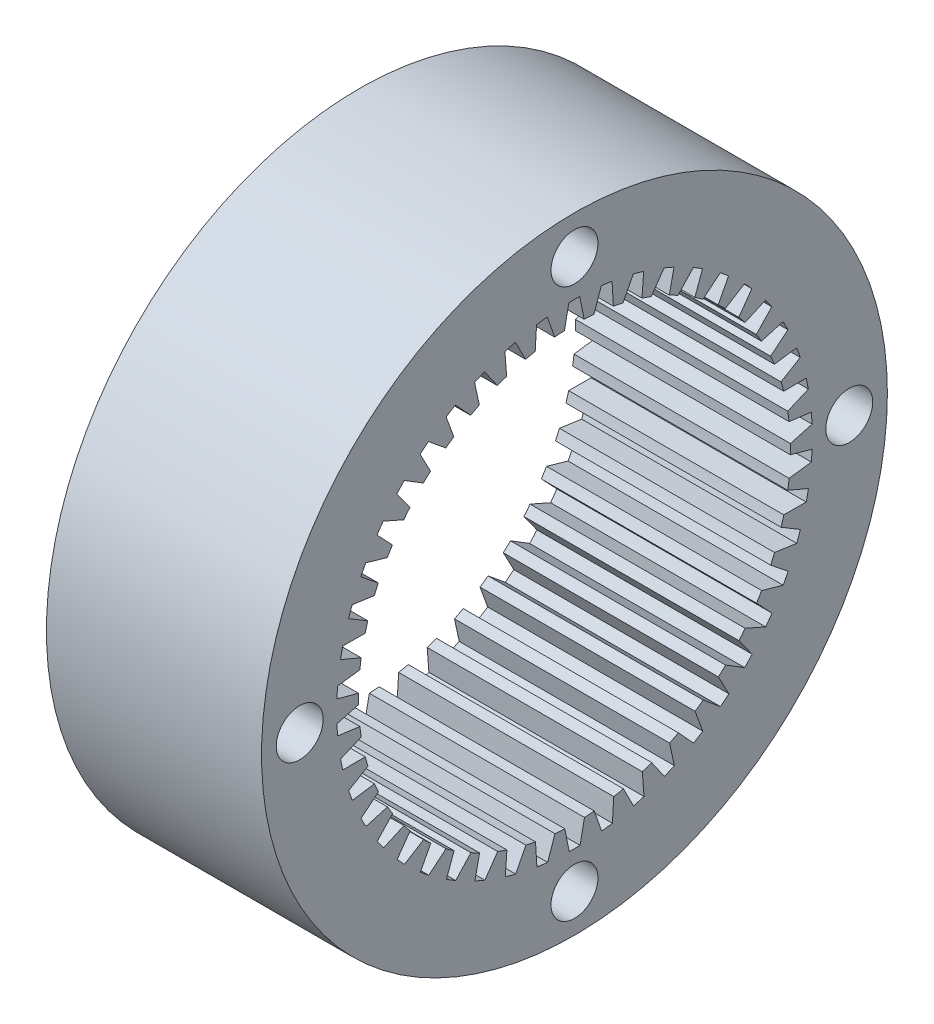
from build123d import *

# Parameters (mm, degrees)
ESQUISSE1_R        = 16
ESQUISSE1_R_2      = 1.2
BOSS_EXTRU_1_DEPTH = 11


with BuildPart() as part:
    # Esquisse1 → Boss.-Extru.1 (new body)
    with BuildSketch(Plane(origin=(0, 0, 0), x_dir=(0, -1, 0), z_dir=(-1, 0, 0))):
        with Locations(Location((0, 0, 0), (0, 0, 270))):
            Circle(ESQUISSE1_R)
        with Locations(Location((0, -14.05, 0), (0, 0, 270))):
            Circle(ESQUISSE1_R_2, mode=Mode.SUBTRACT)
        with Locations(Location((14.05, 0, 0), (0, 0, 270))):
            Circle(ESQUISSE1_R_2, mode=Mode.SUBTRACT)
        with Locations(Location((0, 14.05, 0), (0, 0, 270))):
            Circle(ESQUISSE1_R_2, mode=Mode.SUBTRACT)
        with Locations(Location((-14.05, 0, 0), (0, 0, 270))):
            Circle(ESQUISSE1_R_2, mode=Mode.SUBTRACT)
        with BuildLine():
            Line((5.515041085, -9.56897602), (5.831213426, -10.671779185))
            ThreePointArc((5.831213426, -10.671779185), (5.586655697, -10.801814622), (5.339199898, -10.926246631))
            Line((5.339199898, -10.926246631), (4.621931319, -10.03088885))
            ThreePointArc((4.621931319, -10.03088885), (4.392452427, -10.1334763), (4.160698295, -10.230814726))
            Line((4.160698295, -10.230814726), (4.323760778, -11.36639845))
            ThreePointArc((4.323760778, -11.36639845), (4.063774383, -11.461922123), (3.801679911, -11.55149994))
            Line((3.801679911, -11.55149994), (3.213009879, -10.56681351))
            ThreePointArc((3.213009879, -10.56681351), (2.971699377, -10.637198083), (2.728849568, -10.70207271))
            Line((2.728849568, -10.70207271), (2.735764647, -11.849283219))
            ThreePointArc((2.735764647, -11.849283219), (2.465192642, -11.908515703), (2.19334182, -11.96157066))
            Line((2.19334182, -11.96157066), (1.744236145, -10.905898428))
            ThreePointArc((1.744236145, -10.905898428), (1.49558919, -10.942768993), (1.246167536, -10.973971329))
            Line((1.246167536, -10.973971329), (1.096806398, -12.11143826))
            ThreePointArc((1.096806398, -12.11143826), (0.820689025, -12.133276166), (0.544145921, -12.148819952))
            Line((0.544145921, -12.148819952), (0.242970591, -11.041827093))
            ThreePointArc((0.242970591, -11.041827093), (-0.008380994, -11.04449682), (-0.259728238, -11.041445625))
            Line((-0.259728238, -11.041445625), (-0.56258328, -12.147980122))
            ThreePointArc((-0.56258328, -12.147980122), (-0.839102475, -12.132016652), (-1.115186386, -12.109759714))
            Line((-1.115186386, -12.109759714), (-1.262821045, -10.97206741))
            ThreePointArc((-1.262821045, -10.97206741), (-1.512195056, -10.940486569), (-1.760785767, -10.903238681))
            Line((-1.760785767, -10.903238681), (-2.211493095, -11.9582281))
            ThreePointArc((-2.211493095, -11.9582281), (-2.483263083, -11.904760622), (-2.753744882, -11.845117565))
            Line((-2.753744882, -11.845117565), (-2.745088715, -10.697918872))
            ThreePointArc((-2.745088715, -10.697918872), (-2.987839785, -10.632675753), (-3.229043189, -10.56192503))
            Line((-3.229043189, -10.56192503), (-3.819206979, -11.545716914))
            ThreePointArc((-3.819206979, -11.545716914), (-4.081165199, -11.455741426), (-4.34100632, -11.359823288))
            Line((-4.34100632, -11.359823288), (-4.176220576, -10.224488347))
            ThreePointArc((-4.176220576, -10.224488347), (-4.407826713, -10.126798306), (-4.637149646, -10.023862699))
            Line((-4.637149646, -10.023862699), (-5.355776262, -10.918130867))
            ThreePointArc((-5.355776262, -10.918130867), (-5.603042929, -10.793323443), (-5.847403025, -10.662916996))
            Line((-5.847403025, -10.662916996), (-5.529557349, -9.560594949))
            ThreePointArc((-5.529557349, -9.560594949), (-5.745704168, -9.432277766), (-5.958874779, -9.299074772))
            Line((-5.958874779, -9.299074772), (-6.792577568, -10.0871607))
            ThreePointArc((-6.792577568, -10.0871607), (-7.020546571, -9.929846265), (-7.244873674, -9.767380736))
            Line((-7.244873674, -9.767380736), (-6.779888931, -8.718605756))
            ThreePointArc((-6.779888931, -8.718605756), (-6.976550026, -8.562051739), (-7.169597349, -8.401062677))
            Line((-7.169597349, -8.401062677), (-8.102846005, -9.068285815))
            ThreePointArc((-8.102846005, -9.068285815), (-8.307270713, -8.88139484), (-8.507386035, -8.689896654))
            Line((-8.507386035, -8.689896654), (-7.90392401, -7.714205435))
            ThreePointArc((-7.90392401, -7.714205435), (-8.077435958, -7.532330888), (-8.246763886, -7.34655468))
            Line((-8.246763886, -7.34655468), (-9.262173753, -7.880485923))
            ThreePointArc((-9.262173753, -7.880485923), (-9.43924612, -7.667499833), (-9.611421891, -7.450536238))
            Line((-9.611421891, -7.450536238), (-8.88072394, -6.566104062))
            ThreePointArc((-8.88072394, -6.566104062), (-9.02785454, -6.362296964), (-9.170308815, -6.155194269))
            Line((-9.170308815, -6.155194269), (-10.248964728, -6.545887488))
            ThreePointArc((-10.248964728, -6.545887488), (-10.395386231, -6.310773812), (-10.536415142, -6.07238643))
            Line((-10.536415142, -6.07238643), (-9.692092786, -5.295688594))
            ThreePointArc((-9.692092786, -5.295688594), (-9.810101274, -5.073745485), (-9.923028242, -4.849174235))
            Line((-9.923028242, -4.849174235), (-11.044836882, -5.089351555))
            ThreePointArc((-11.044836882, -5.089351555), (-11.157879966, -4.836490015), (-11.265134915, -4.581119551))
            Line((-11.265134915, -4.581119551), (-10.322916281, -3.926624467))
            ThreePointArc((-10.322916281, -3.926624467), (-10.409604382, -3.690679728), (-10.490900428, -3.452823259))
            Line((-10.490900428, -3.452823259), (-11.634964623, -3.538010632))
            ThreePointArc((-11.634964623, -3.538010632), (-11.712523509, -3.27211156), (-11.784006539, -3.004515084))
            Line((-11.784006539, -3.004515084), (-10.761443378, -2.484414756))
            ThreePointArc((-10.761443378, -2.484414756), (-10.815196257, -2.238863591), (-10.863346988, -1.99215272))
            Line((-10.863346988, -1.99215272), (-12.008354986, -1.920763265))
            ThreePointArc((-12.008354986, -1.920763265), (-12.048984899, -1.646779857), (-12.083364417, -1.371942185))
            Line((-12.083364417, -1.371942185), (-10.999505146, -0.995925099))
            ThreePointArc((-10.999505146, -0.995925099), (-11.019321488, -0.745341661), (-11.033429949, -0.494372145))
            Line((-11.033429949, -0.494372145), (-12.158052418, -0.267735713))
            ThreePointArc((-12.158052418, -0.267735713), (-12.160996499, 0.009228238), (-12.157632079, 0.286187401))
            Line((-12.157632079, 0.286187401), (-11.032666945, 0.511116758))
            ThreePointArc((-11.032666945, 0.511116758), (-11.01817761, 0.762064574), (-10.997980985, 1.012617648))
            Line((-10.997980985, 1.012617648), (-12.081268336, 1.390279249))
            ThreePointArc((-12.081268336, 1.390279249), (-12.046471743, 1.665064428), (-12.005426058, 1.938985858))
            Line((-12.005426058, 1.938985858), (-10.860311033, 2.008637478))
            ThreePointArc((-10.860311033, 2.008637478), (-10.811785929, 2.255274987), (-10.757660445, 2.50074429))
            Line((-10.757660445, 2.50074429), (-11.779433084, 3.022395939))
            ThreePointArc((-11.779433084, 3.022395939), (-11.707544011, 3.289883619), (-11.629581665, 3.555664676))
            Line((-11.629581665, 3.555664676), (-10.485648075, 3.468741081))
            ThreePointArc((-10.485648075, 3.468741081), (-10.403991134, 3.706473895), (-10.316945045, 3.942286798))
            Line((-10.316945045, 3.942286798), (-11.258169281, 4.598211112))
            ThreePointArc((-11.258169281, 4.598211112), (-11.150526886, 4.853418503), (-11.03710017, 5.106108189))
            Line((-11.03710017, 5.106108189), (-9.915657334, 4.864228602))
            ThreePointArc((-9.915657334, 4.864228602), (-9.802389669, 5.088628207), (-9.684044479, 5.310391962))
            Line((-9.684044479, 5.310391962), (-10.527187086, 6.088370312))
            ThreePointArc((-10.527187086, 6.088370312), (-10.385796543, 6.326543383), (-10.239018381, 6.561434568))
            Line((-10.239018381, 6.561434568), (-9.160956657, 6.169104747))
            ThreePointArc((-9.160956657, 6.169104747), (-9.018188231, 6.375991004), (-8.870748487, 6.579574571))
            Line((-8.870748487, 6.579574571), (-9.600103314, 7.465114692))
            ThreePointArc((-9.600103314, 7.465114692), (-9.427598461, 7.68181673), (-9.250203053, 7.894533835))
            Line((-9.250203053, 7.894533835), (-8.235604691, 7.359062143))
            ThreePointArc((-8.235604691, 7.359062143), (-8.065995009, 7.544581152), (-7.892207235, 7.726192155))
            Line((-7.892207235, 7.726192155), (-8.494187781, 8.70279811))
            ThreePointArc((-8.494187781, 8.70279811), (-8.293782057, 8.893992365), (-8.089073944, 9.080572874))
            Line((-8.089073944, 9.080572874), (-7.156838992, 8.411934135))
            ThreePointArc((-7.156838992, 8.411934135), (-6.963547562, 8.572630028), (-6.766649095, 8.728885397))
            Line((-6.766649095, 8.728885397), (-7.230041601, 9.778364866))
            ThreePointArc((-7.230041601, 9.778364866), (-7.005468186, 9.940489752), (-6.777260693, 10.097458022))
            Line((-6.777260693, 10.097458022), (-5.944754924, 9.30810771))
            ThreePointArc((-5.944754924, 9.30810771), (-5.7313824, 9.440987027), (-5.515041085, 9.56897602))
            Line((-5.515041085, 9.56897602), (-5.831213426, 10.671779185))
            ThreePointArc((-5.831213426, 10.671779185), (-5.586655697, 10.801814622), (-5.339199898, 10.926246631))
            Line((-5.339199898, 10.926246631), (-4.621931319, 10.03088885))
            ThreePointArc((-4.621931319, 10.03088885), (-4.392452427, 10.1334763), (-4.160698295, 10.230814726))
            Line((-4.160698295, 10.230814726), (-4.323760778, 11.36639845))
            ThreePointArc((-4.323760778, 11.36639845), (-4.063774383, 11.461922123), (-3.801679911, 11.55149994))
            Line((-3.801679911, 11.55149994), (-3.213009879, 10.56681351))
            ThreePointArc((-3.213009879, 10.56681351), (-2.971699377, 10.637198083), (-2.728849568, 10.70207271))
            Line((-2.728849568, 10.70207271), (-2.735764647, 11.849283219))
            ThreePointArc((-2.735764647, 11.849283219), (-2.465192642, 11.908515703), (-2.19334182, 11.96157066))
            Line((-2.19334182, 11.96157066), (-1.744236145, 10.905898428))
            ThreePointArc((-1.744236145, 10.905898428), (-1.49558919, 10.942768993), (-1.246167536, 10.973971329))
            Line((-1.246167536, 10.973971329), (-1.096806398, 12.11143826))
            ThreePointArc((-1.096806398, 12.11143826), (-0.820689025, 12.133276166), (-0.544145921, 12.148819952))
            Line((-0.544145921, 12.148819952), (-0.242970591, 11.041827093))
            ThreePointArc((-0.242970591, 11.041827093), (0.008380994, 11.04449682), (0.259728238, 11.041445625))
            Line((0.259728238, 11.041445625), (0.56258328, 12.147980122))
            ThreePointArc((0.56258328, 12.147980122), (0.839102475, 12.132016652), (1.115186386, 12.109759714))
            Line((1.115186386, 12.109759714), (1.262821045, 10.97206741))
            ThreePointArc((1.262821045, 10.97206741), (1.512195056, 10.940486569), (1.760785767, 10.903238681))
            Line((1.760785767, 10.903238681), (2.211493095, 11.9582281))
            ThreePointArc((2.211493095, 11.9582281), (2.483263083, 11.904760622), (2.753744882, 11.845117565))
            Line((2.753744882, 11.845117565), (2.745088715, 10.697918872))
            ThreePointArc((2.745088715, 10.697918872), (2.987839785, 10.632675753), (3.229043189, 10.56192503))
            Line((3.229043189, 10.56192503), (3.819206979, 11.545716914))
            ThreePointArc((3.819206979, 11.545716914), (4.081165199, 11.455741426), (4.34100632, 11.359823288))
            Line((4.34100632, 11.359823288), (4.176220576, 10.224488347))
            ThreePointArc((4.176220576, 10.224488347), (4.407826713, 10.126798306), (4.637149646, 10.023862699))
            Line((4.637149646, 10.023862699), (5.355776262, 10.918130867))
            ThreePointArc((5.355776262, 10.918130867), (5.603042929, 10.793323443), (5.847403025, 10.662916996))
            Line((5.847403025, 10.662916996), (5.529557349, 9.560594949))
            ThreePointArc((5.529557349, 9.560594949), (5.745704168, 9.432277766), (5.958874779, 9.299074772))
            Line((5.958874779, 9.299074772), (6.792577568, 10.0871607))
            ThreePointArc((6.792577568, 10.0871607), (7.020546571, 9.929846265), (7.244873674, 9.767380736))
            Line((7.244873674, 9.767380736), (6.779888931, 8.718605756))
            ThreePointArc((6.779888931, 8.718605756), (6.976550026, 8.562051739), (7.169597349, 8.401062677))
            Line((7.169597349, 8.401062677), (8.102846005, 9.068285815))
            ThreePointArc((8.102846005, 9.068285815), (8.307270713, 8.88139484), (8.507386035, 8.689896654))
            Line((8.507386035, 8.689896654), (7.90392401, 7.714205435))
            ThreePointArc((7.90392401, 7.714205435), (8.077435958, 7.532330888), (8.246763886, 7.34655468))
            Line((8.246763886, 7.34655468), (9.262173753, 7.880485923))
            ThreePointArc((9.262173753, 7.880485923), (9.43924612, 7.667499833), (9.611421891, 7.450536238))
            Line((9.611421891, 7.450536238), (8.88072394, 6.566104062))
            ThreePointArc((8.88072394, 6.566104062), (9.02785454, 6.362296964), (9.170308815, 6.155194269))
            Line((9.170308815, 6.155194269), (10.248964728, 6.545887488))
            ThreePointArc((10.248964728, 6.545887488), (10.395386231, 6.310773812), (10.536415142, 6.07238643))
            Line((10.536415142, 6.07238643), (9.692092786, 5.295688594))
            ThreePointArc((9.692092786, 5.295688594), (9.810101274, 5.073745485), (9.923028242, 4.849174235))
            Line((9.923028242, 4.849174235), (11.044836882, 5.089351555))
            ThreePointArc((11.044836882, 5.089351555), (11.157879966, 4.836490015), (11.265134915, 4.581119551))
            Line((11.265134915, 4.581119551), (10.322916281, 3.926624467))
            ThreePointArc((10.322916281, 3.926624467), (10.409604382, 3.690679728), (10.490900428, 3.452823259))
            Line((10.490900428, 3.452823259), (11.634964623, 3.538010632))
            ThreePointArc((11.634964623, 3.538010632), (11.712523509, 3.27211156), (11.784006539, 3.004515084))
            Line((11.784006539, 3.004515084), (10.761443378, 2.484414756))
            ThreePointArc((10.761443378, 2.484414756), (10.815196257, 2.238863591), (10.863346988, 1.99215272))
            Line((10.863346988, 1.99215272), (12.008354986, 1.920763265))
            ThreePointArc((12.008354986, 1.920763265), (12.048984899, 1.646779857), (12.083364417, 1.371942185))
            Line((12.083364417, 1.371942185), (10.999505146, 0.995925099))
            ThreePointArc((10.999505146, 0.995925099), (11.019321488, 0.745341661), (11.033429949, 0.494372145))
            Line((11.033429949, 0.494372145), (12.158052418, 0.267735713))
            ThreePointArc((12.158052418, 0.267735713), (12.160996499, -0.009228238), (12.157632079, -0.286187401))
            Line((12.157632079, -0.286187401), (11.032666945, -0.511116758))
            ThreePointArc((11.032666945, -0.511116758), (11.01817761, -0.762064574), (10.997980985, -1.012617648))
            Line((10.997980985, -1.012617648), (12.081268336, -1.390279249))
            ThreePointArc((12.081268336, -1.390279249), (12.046471743, -1.665064428), (12.005426058, -1.938985858))
            Line((12.005426058, -1.938985858), (10.860311033, -2.008637478))
            ThreePointArc((10.860311033, -2.008637478), (10.811785929, -2.255274987), (10.757660445, -2.50074429))
            Line((10.757660445, -2.50074429), (11.779433084, -3.022395939))
            ThreePointArc((11.779433084, -3.022395939), (11.707544011, -3.289883619), (11.629581665, -3.555664676))
            Line((11.629581665, -3.555664676), (10.485648075, -3.468741081))
            ThreePointArc((10.485648075, -3.468741081), (10.403991134, -3.706473895), (10.316945045, -3.942286798))
            Line((10.316945045, -3.942286798), (11.258169281, -4.598211112))
            ThreePointArc((11.258169281, -4.598211112), (11.150526886, -4.853418503), (11.03710017, -5.106108189))
            Line((11.03710017, -5.106108189), (9.915657334, -4.864228602))
            ThreePointArc((9.915657334, -4.864228602), (9.802389669, -5.088628207), (9.684044479, -5.310391962))
            Line((9.684044479, -5.310391962), (10.527187086, -6.088370312))
            ThreePointArc((10.527187086, -6.088370312), (10.385796543, -6.326543383), (10.239018381, -6.561434568))
            Line((10.239018381, -6.561434568), (9.160956657, -6.169104747))
            ThreePointArc((9.160956657, -6.169104747), (9.018188231, -6.375991004), (8.870748487, -6.579574571))
            Line((8.870748487, -6.579574571), (9.600103314, -7.465114692))
            ThreePointArc((9.600103314, -7.465114692), (9.427598461, -7.68181673), (9.250203053, -7.894533835))
            Line((9.250203053, -7.894533835), (8.235604691, -7.359062143))
            ThreePointArc((8.235604691, -7.359062143), (8.065995009, -7.544581152), (7.892207235, -7.726192155))
            Line((7.892207235, -7.726192155), (8.494187781, -8.70279811))
            ThreePointArc((8.494187781, -8.70279811), (8.293782057, -8.893992365), (8.089073944, -9.080572874))
            Line((8.089073944, -9.080572874), (7.156838992, -8.411934135))
            ThreePointArc((7.156838992, -8.411934135), (6.963547562, -8.572630028), (6.766649095, -8.728885397))
            Line((6.766649095, -8.728885397), (7.230041601, -9.778364866))
            ThreePointArc((7.230041601, -9.778364866), (7.005468186, -9.940489752), (6.777260693, -10.097458022))
            Line((6.777260693, -10.097458022), (5.944754924, -9.30810771))
            ThreePointArc((5.944754924, -9.30810771), (5.7313824, -9.440987027), (5.515041085, -9.56897602))
        make_face(mode=Mode.SUBTRACT)
    extrude(amount=-BOSS_EXTRU_1_DEPTH)


solid = part.part
